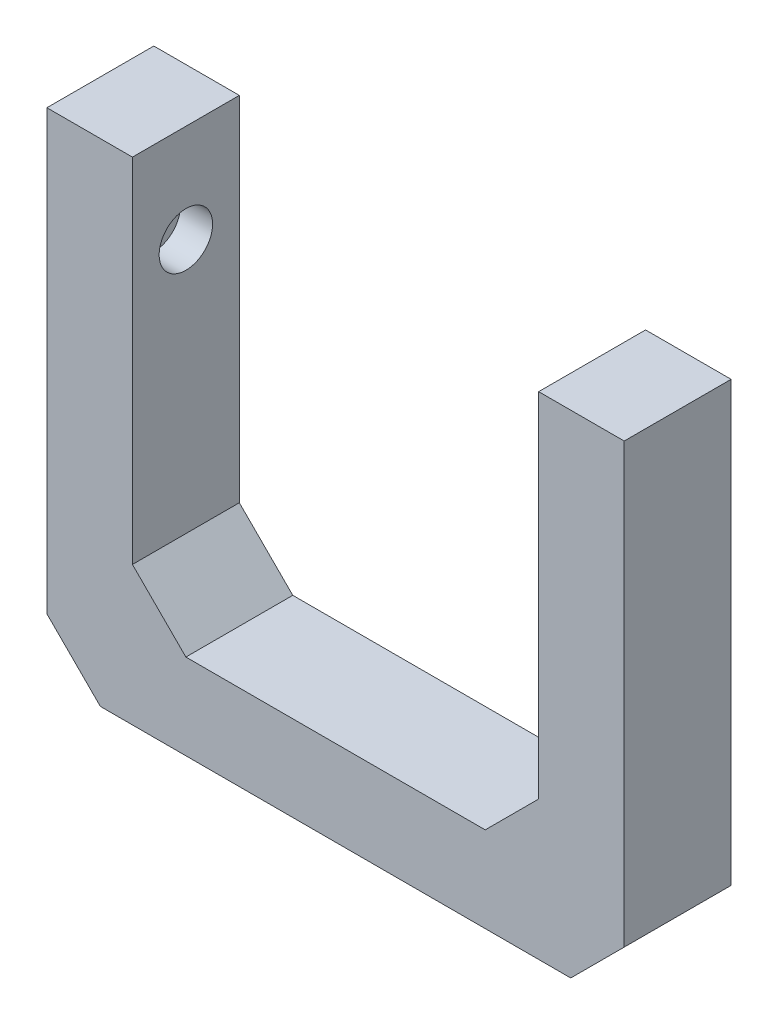
from build123d import *

# Parameters (mm, degrees)
BOSS_EXTRUDE1_DEPTH = 10
SKETCH2_R           = 2.5
CUT_EXTRUDE1_DEPTH  = 3


with BuildPart() as part:
    # Sketch1 → Boss-Extrude1 (new body)
    with BuildSketch(Plane.XY):
        Polygon((-27, 38), (-19, 38), (-19, 5), (-14, 0), (14, 0), (19, 5), (19, 38), (27, 38), (27, -3), (22, -8), (-22, -8), (-27, -3), align=None)
    extrude(amount=BOSS_EXTRUDE1_DEPTH)

    # Sketch2 → Cut-Extrude1 (cut)
    with BuildSketch(Plane(origin=(-19, 0, 0), x_dir=(0, 0, -1), z_dir=(1, 0, 0))):
        with Locations(Location((-5, 28.83, 0), (0, 0, 90))):
            Circle(SKETCH2_R)
    extrude(amount=-CUT_EXTRUDE1_DEPTH, mode=Mode.SUBTRACT)


solid = part.part
